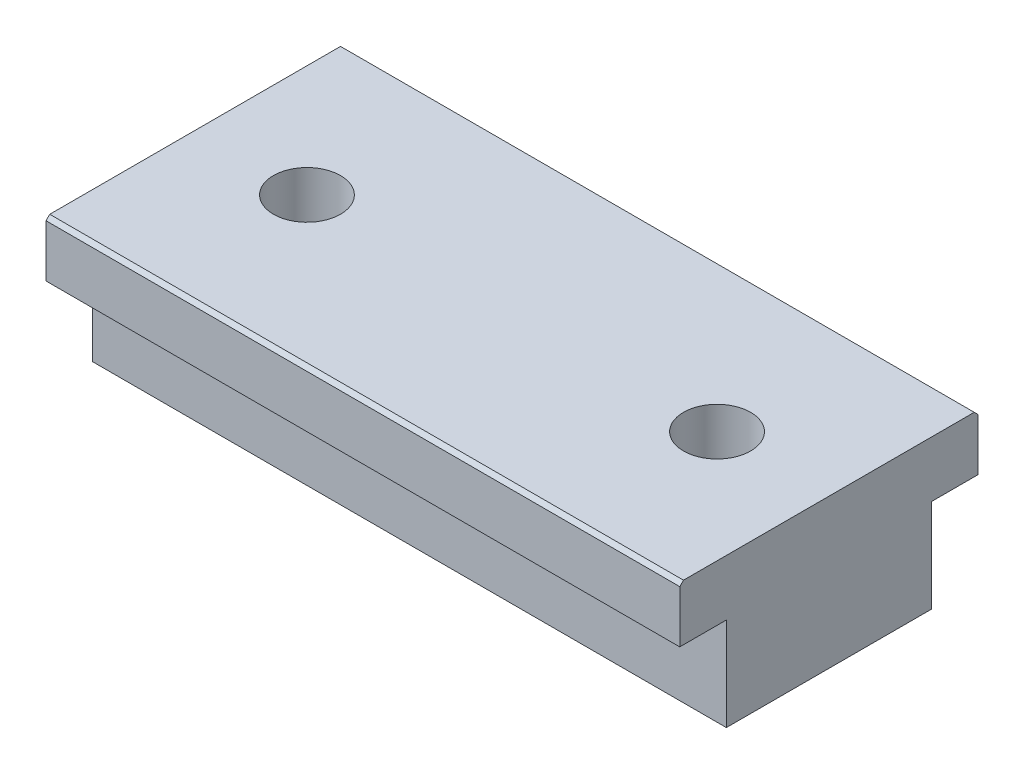
from build123d import *

# Parameters (mm, degrees)
EXTRUDE_1_DEPTH           = 170
HOLE_WIZARD_1_D           = 11
HOLE_WIZARD_1_CBORE_D     = 18
HOLE_WIZARD_1_CBORE_DEPTH = 15
CHAMFER_1_SIZE            = 1


with BuildPart() as part:
    # 草图2 → 凸台-拉伸1 (new body)
    with BuildSketch(Plane(origin=(0, 0, 0), x_dir=(0, 0, -1), z_dir=(1, 0, 0))):
        Polygon((0, 0), (80, 0), (80, -15), (67.5, -15), (67.5, -40), (12.5, -40), (12.5, -15), (0, -15), align=None)
    extrude(amount=EXTRUDE_1_DEPTH)

    # 孔1 (through all)
    with Locations(Plane(origin=(30, 0, -40), x_dir=(0, 0, 1), z_dir=(0, 1, 0))):
        with Locations((0, 0), (0, 110)):
            CounterBoreHole(HOLE_WIZARD_1_D / 2, HOLE_WIZARD_1_CBORE_D / 2, HOLE_WIZARD_1_CBORE_DEPTH)

    # 倒角1
    chamfer_1_edges = [part.edges().sort_by_distance(p)[0] for p in [
        (85, 0, 0),
        (85, 0, -80),
    ]]
    chamfer(chamfer_1_edges, length=CHAMFER_1_SIZE)


solid = part.part
